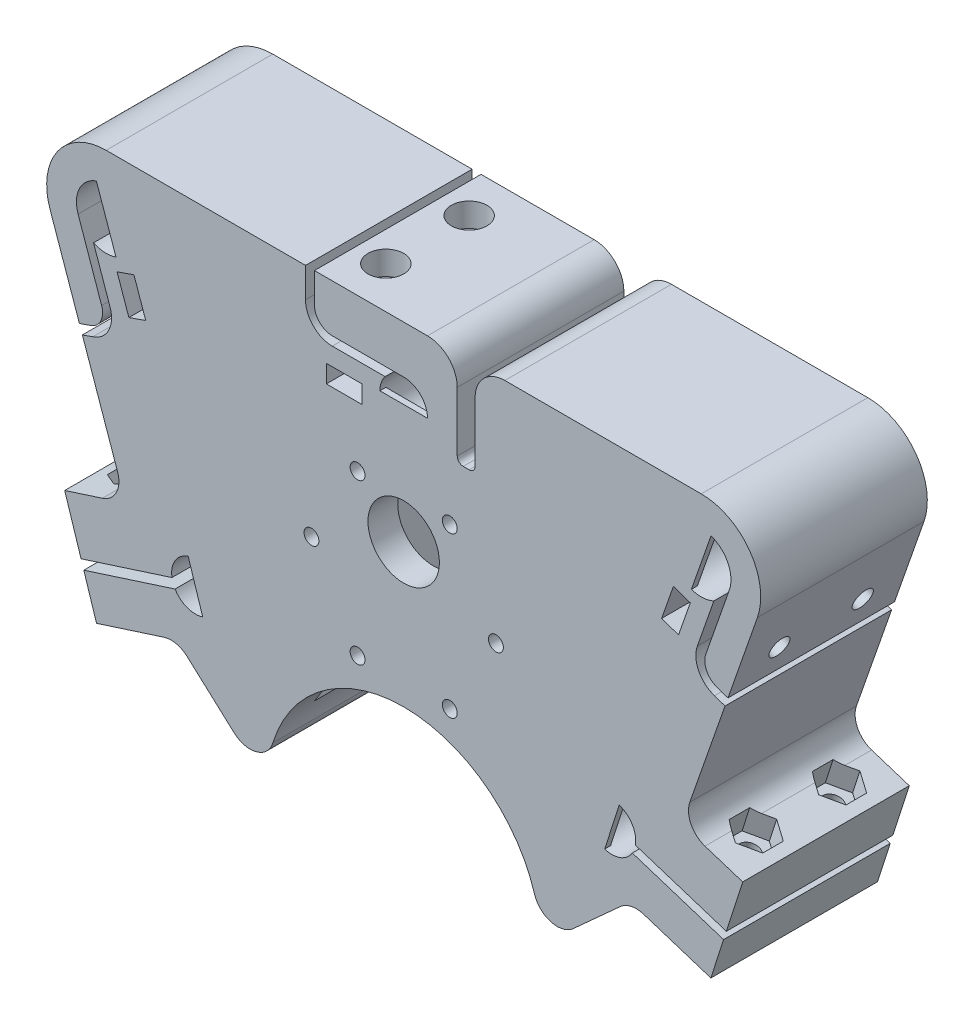
from build123d import *

# Parameters (mm, degrees)
SZKIC1_R                    = 1.25
SZKIC1_R_2                  = 6
DODANIE_WYCI_GNI_CIE1_DEPTH = 28
ZAOKR_GLENIE1_R             = 4
SZKIC2_R                    = 1.7
WYTNIJ_WYCI_GNI_CIE1_DEPTH  = 92.934955481
SZKIC3_R                    = 3
WYTNIJ_WYCI_GNI_CIE2_DEPTH  = 3
WYTNIJ_WYCI_GNI_CIE3_DEPTH  = 4
SZKIC5_R                    = 1.7
WYTNIJ_WYCI_GNI_CIE4_DEPTH  = 10
WYTNIJ_WYCI_GNI_CIE5_START  = -9.5
WYTNIJ_WYCI_GNI_CIE5_DEPTH  = 3
SZKIC7_R                    = 1.7
WYTNIJ_WYCI_GNI_CIE6_DEPTH  = 14
WYTNIJ_WYCI_GNI_CIE7_START  = -12.5
WYTNIJ_WYCI_GNI_CIE7_DEPTH  = 3
DODANIE_WYCI_GNI_CIE2_START = -1
DODANIE_WYCI_GNI_CIE2_DEPTH = 1
WYTNIJ_WYCI_GNI_CIE8_DEPTH  = 23
SZKIC14_R                   = 3
WYTNIJ_WYCI_GNI_CIE9_DEPTH  = 4


with BuildPart() as part:
    # Szkic1 → Dodanie-wyciągnięcie1 (new body)
    with BuildSketch(Plane.XY):
        with BuildLine():
            Line((-16.5, 10), (-50, 10))
            ThreePointArc((-50, 10), (-58.153539415, 5.789628228), (-59.44119239, -3.296040997))
            Line((-59.44119239, -3.296040997), (-54.497130895, -17.457829582))
            Line((-54.497130895, -17.457829582), (-52.608892417, -16.798621383))
            ThreePointArc((-52.608892417, -16.798621383), (-50.895729486, -15.269847132), (-50.765346999, -12.977451367))
            Line((-50.765346999, -12.977451367), (-54.720596195, -1.648020498))
            ThreePointArc((-54.720596195, -1.648020498), (-46.287105711, 3.348793215), (-52.124779238, -4.526070392))
            Line((-52.124779238, -4.526070392), (-49.347144245, -12.482338649))
            ThreePointArc((-49.347144245, -12.482338649), (-49.573478973, -15.984903044), (-52.245639943, -18.260587666))
            Line((-52.245639943, -18.260587666), (-54.002724745, -18.874008441))
            Line((-54.002724745, -18.874008441), (-46.73072499, -39.703952248))
            Line((-46.73072499, -39.703952248), (-56.971706107, -42.992648268))
            Line((-56.971706107, -42.992648268), (-54.219935067, -51.561647984))
            Line((-54.219935067, -51.561647984), (-38.945736554, -46.656630069))
            ThreePointArc((-38.945736554, -46.656630069), (-31.247605059, -44.614528164), (-38.425704632, -48.065078151))
            Line((-38.425704632, -48.065078151), (-53.76130656, -52.989814604))
            Line((-53.76130656, -52.989814604), (-51.621040196, -59.654592161))
            Line((-51.621040196, -59.654592161), (-38.116801548, -55.317963143))
            Line((-38.116801548, -55.317963143), (-23, -69))
            ThreePointArc((-23, -69), (0, -46), (23, -69))
            Line((23, -69), (38.116801548, -55.317963143))
            Line((38.116801548, -55.317963143), (51.621040196, -59.654592161))
            Line((51.621040196, -59.654592161), (53.76130656, -52.989814604))
            Line((53.76130656, -52.989814604), (38.425704632, -48.065078151))
            ThreePointArc((38.425704632, -48.065078151), (31.247605059, -44.614528164), (38.945736554, -46.656630069))
            Line((38.945736554, -46.656630069), (54.219935067, -51.561647984))
            Line((54.219935067, -51.561647984), (56.971706107, -42.992648268))
            Line((56.971706107, -42.992648268), (46.73072499, -39.703952248))
            Line((46.73072499, -39.703952248), (54.002724745, -18.874008441))
            Line((54.002724745, -18.874008441), (52.245639943, -18.260587666))
            ThreePointArc((52.245639943, -18.260587666), (49.573478973, -15.984903044), (49.347144245, -12.482338649))
            Line((49.347144245, -12.482338649), (52.124779238, -4.526070392))
            ThreePointArc((52.124779238, -4.526070392), (46.287105711, 3.348793215), (54.720596195, -1.648020498))
            Line((54.720596195, -1.648020498), (50.765346999, -12.977451367))
            ThreePointArc((50.765346999, -12.977451367), (50.895729486, -15.269847132), (52.608892417, -16.798621383))
            Line((52.608892417, -16.798621383), (54.497130895, -17.457829582))
            Line((54.497130895, -17.457829582), (59.44119239, -3.296040997))
            ThreePointArc((59.44119239, -3.296040997), (58.153539415, 5.789628228), (50, 10))
            Line((50, 10), (17, 10))
            ThreePointArc((17, 10), (13.464466094, 8.535533906), (12, 5))
            Line((12, 5), (12, -5))
            ThreePointArc((12, -5), (11.707106781, -5.707106781), (11, -6))
            Line((11, -6), (10, -6))
            ThreePointArc((10, -6), (9.292893219, -5.707106781), (9, -5))
            Line((9, -5), (9, 5))
            ThreePointArc((9, 5), (7.535533906, 8.535533906), (4, 10))
            Line((4, 10), (-15, 10))
            Line((-15, 10), (-15, 5))
            ThreePointArc((-15, 5), (-14.121320344, 2.878679656), (-12, 2))
            Line((-12, 2), (0, 2))
            ThreePointArc((0, 2), (1.732050808, -5.605551275), (-3.122498999, 0.5))
            Line((-3.122498999, 0.5), (-12, 0.5))
            ThreePointArc((-12, 0.5), (-15.181980515, 1.818019485), (-16.5, 5))
            Line((-16.5, 5), (-16.5, 10))
        make_face()
        with Locations((-7.75, -42.423393759)):
            Circle(SZKIC1_R, mode=Mode.SUBTRACT)
        with Locations((7.75, -42.423393759)):
            Circle(SZKIC1_R, mode=Mode.SUBTRACT)
        with Locations((-15.5, -29)):
            Circle(SZKIC1_R, mode=Mode.SUBTRACT)
        with Locations((0, -22)):
            Circle(SZKIC1_R_2, mode=Mode.SUBTRACT)
        with Locations((-7.75, -15.576606241)):
            Circle(SZKIC1_R, mode=Mode.SUBTRACT)
        with Locations((15.5, -29)):
            Circle(SZKIC1_R, mode=Mode.SUBTRACT)
        with Locations((7.75, -15.576606241)):
            Circle(SZKIC1_R, mode=Mode.SUBTRACT)
    extrude(amount=DODANIE_WYCI_GNI_CIE1_DEPTH)

    # Zaokrąglenie1
    zaokr_glenie1_edges = [part.edges().sort_by_distance(p)[0] for p in [
        (-46.73072499, -39.703952248, 14),
        (-38.116801548, -55.317963143, 14),
        (-23, -69, 14),
        (23, -69, 14),
        (38.116801548, -55.317963143, 14),
        (46.73072499, -39.703952248, 14),
    ]]
    fillet(zaokr_glenie1_edges, radius=ZAOKR_GLENIE1_R)

    # Szkic2 → Wytnij-wyciągnięcie1 (cut, through all)
    with BuildSketch(Plane(origin=(12.540292842, -39.050402177, 0), x_dir=(0.9521110796259562, 0.3057523377727409, 0), z_dir=(0.3057523377727409, -0.9521110796259562, 0))):
        with Locations((-62.388495324, 21)):
            Circle(SZKIC2_R)
        with Locations((-62.388495324, 7)):
            Circle(SZKIC2_R)
    wytnij_wyci_gni_cie1 = extrude(amount=-WYTNIJ_WYCI_GNI_CIE1_DEPTH, mode=Mode.SUBTRACT)

    # Szkic3 → Wytnij-wyciągnięcie2 (cut)
    with BuildSketch(Plane(origin=(12.540292842, -39.050402177, 0), x_dir=(0.9521110796259562, 0.3057523377727409, 0), z_dir=(0.3057523377727409, -0.9521110796259562, 0))):
        with Locations((-62.388495324, 21)):
            Circle(SZKIC3_R)
        with Locations((-62.388495324, 7)):
            Circle(SZKIC3_R)
    wytnij_wyci_gni_cie2 = extrude(amount=-WYTNIJ_WYCI_GNI_CIE2_DEPTH, mode=Mode.SUBTRACT)

    # Szkic4 → Wytnij-wyciągnięcie3 (cut, symmetric)
    with BuildSketch(Plane(origin=(7.189626931, -22.388458283, 0), x_dir=(0.9521110796259562, 0.30575233777274063, 0), z_dir=(-0.30575233777274063, 0.9521110796259562, 0))):
        Polygon((-62.388495324, -24.464101615), (-59.388495324, -22.732050808), (-59.388495324, -19.267949192), (-62.388495324, -17.535898385), (-65.388495324, -19.267949192), (-65.388495324, -22.732050808), align=None)
        Polygon((-62.388495324, -10.464101615), (-59.388495324, -8.732050808), (-59.388495324, -5.267949192), (-62.388495324, -3.535898385), (-65.388495324, -5.267949192), (-65.388495324, -8.732050808), align=None)
    wytnij_wyci_gni_cie3 = extrude(amount=WYTNIJ_WYCI_GNI_CIE3_DEPTH, both=True, mode=Mode.SUBTRACT)

    # Szkic5 → Wytnij-wyciągnięcie4 (cut)
    with BuildSketch(Plane(origin=(-54.009249264, -18.855319585, 0), x_dir=(0, 0, 1), z_dir=(-0.944119239013413, -0.3296040996782867, 0))):
        with Locations((21, 6.480204984)):
            Circle(SZKIC5_R)
        with Locations((7, 6.480204984)):
            Circle(SZKIC5_R)
    wytnij_wyci_gni_cie4 = extrude(amount=-WYTNIJ_WYCI_GNI_CIE4_DEPTH, mode=Mode.SUBTRACT)

    # Szkic6 → Wytnij-wyciągnięcie5 (cut)
    with BuildSketch(Plane(origin=(-54.009249264, -18.855319585, 0), x_dir=(0, 0, 1), z_dir=(-0.944119239013413, -0.3296040996782867, 0)).offset(WYTNIJ_WYCI_GNI_CIE5_START)):
        Polygon((28, 9.480204984), (19.267949192, 9.480204984), (17.535898385, 6.480204984), (19.267949192, 3.480204984), (28, 3.480204984), align=None)
        Polygon((8.732050808, 3.480204984), (10.464101615, 6.480204984), (8.732050808, 9.480204984), (0, 9.480204984), (0, 3.480204984), align=None)
    wytnij_wyci_gni_cie5 = extrude(amount=-WYTNIJ_WYCI_GNI_CIE5_DEPTH, mode=Mode.SUBTRACT)

    # Lustro1: Wytnij-wyciągnięcie1, Wytnij-wyciągnięcie2, Wytnij-wyciągnięcie3, Wytnij-wyciągnięcie4, Wytnij-wyciągnięcie5 across plane
    add(wytnij_wyci_gni_cie1.mirror(Plane(origin=(0, 0, 0), x_dir=(0, 0, 1), z_dir=(1, 0, 0))), mode=Mode.SUBTRACT)
    add(wytnij_wyci_gni_cie2.mirror(Plane(origin=(0, 0, 0), x_dir=(0, 0, 1), z_dir=(1, 0, 0))), mode=Mode.SUBTRACT)
    add(wytnij_wyci_gni_cie3.mirror(Plane(origin=(0, 0, 0), x_dir=(0, 0, 1), z_dir=(1, 0, 0))), mode=Mode.SUBTRACT)
    add(wytnij_wyci_gni_cie4.mirror(Plane(origin=(0, 0, 0), x_dir=(0, 0, 1), z_dir=(1, 0, 0))), mode=Mode.SUBTRACT)
    add(wytnij_wyci_gni_cie5.mirror(Plane(origin=(0, 0, 0), x_dir=(0, 0, 1), z_dir=(1, 0, 0))), mode=Mode.SUBTRACT)

    # Szkic7 → Wytnij-wyciągnięcie6 (cut)
    with BuildSketch(Plane(origin=(0, 10, 0), x_dir=(1, 0, 0), z_dir=(0, 1, 0))):
        with Locations((-10, -21)):
            Circle(SZKIC7_R)
        with Locations((-10, -7)):
            Circle(SZKIC7_R)
    extrude(amount=-WYTNIJ_WYCI_GNI_CIE6_DEPTH, mode=Mode.SUBTRACT)

    # Szkic8 → Wytnij-wyciągnięcie7 (cut)
    with BuildSketch(Plane(origin=(0, 10, 0), x_dir=(1, 0, 0), z_dir=(0, 1, 0)).offset(WYTNIJ_WYCI_GNI_CIE7_START)):
        Polygon((-7, -28), (-7, -19.267949192), (-10, -17.535898385), (-13, -19.267949192), (-13, -28), align=None)
        Polygon((-13, -8.732050808), (-10, -10.464101615), (-7, -8.732050808), (-7, 0), (-13, 0), align=None)
    extrude(amount=-WYTNIJ_WYCI_GNI_CIE7_DEPTH, mode=Mode.SUBTRACT)

    # Szkic9 → Dodanie-wyciągnięcie2 (add)
    with BuildSketch(Plane.XY.offset(28).offset(DODANIE_WYCI_GNI_CIE2_START)):
        with BuildLine():
            ThreePointArc((-33.776990649, -49.808444319), (-31.191555681, -44.776990649), (-36.223009351, -42.191555681))
            Line((-36.223009351, -42.191555681), (-33.776990649, -49.808444319))
        make_face()
        with BuildLine():
            Line((-51.648020498, 4.720596195), (-48.351979502, -4.720596195))
            ThreePointArc((-48.351979502, -4.720596195), (-45.279403805, 1.648020498), (-51.648020498, 4.720596195))
        make_face()
        with BuildLine():
            ThreePointArc((36.223009351, -42.191555681), (31.191555681, -44.776990649), (33.776990649, -49.808444319))
            Line((33.776990649, -49.808444319), (36.223009351, -42.191555681))
        make_face()
        with BuildLine():
            Line((4, -2), (-4, -2))
            ThreePointArc((-4, -2), (0, -6), (4, -2))
        make_face()
        with BuildLine():
            ThreePointArc((51.648020498, 4.720596195), (45.279403805, 1.648020498), (48.351979502, -4.720596195))
            Line((48.351979502, -4.720596195), (51.648020498, 4.720596195))
        make_face()
    extrude(amount=DODANIE_WYCI_GNI_CIE2_DEPTH)

    # Szkic10 → Wytnij-wyciągnięcie8 (cut)
    with BuildSketch(Plane(origin=(0, 0, 0), x_dir=(-1, 0, 0), z_dir=(0, 0, -1))):
        with BuildLine():
            ThreePointArc((20, -29), (0, -9), (-20, -29))
            Line((-20, -29), (-20, -58.870079081))
            Line((-20, -58.870079081), (20, -58.870079081))
            Line((20, -58.870079081), (20, -29))
        make_face()
    extrude(amount=-WYTNIJ_WYCI_GNI_CIE8_DEPTH, mode=Mode.SUBTRACT)

    # Szkic14 → Wytnij-wyciągnięcie9 (cut)
    with BuildSketch(Plane(origin=(0, 10, 0), x_dir=(1, 0, 0), z_dir=(0, 1, 0))):
        with Locations((-10, -7)):
            Circle(SZKIC14_R)
        with Locations((-10, -21)):
            Circle(SZKIC14_R)
    extrude(amount=-WYTNIJ_WYCI_GNI_CIE9_DEPTH, mode=Mode.SUBTRACT)


solid = part.part
